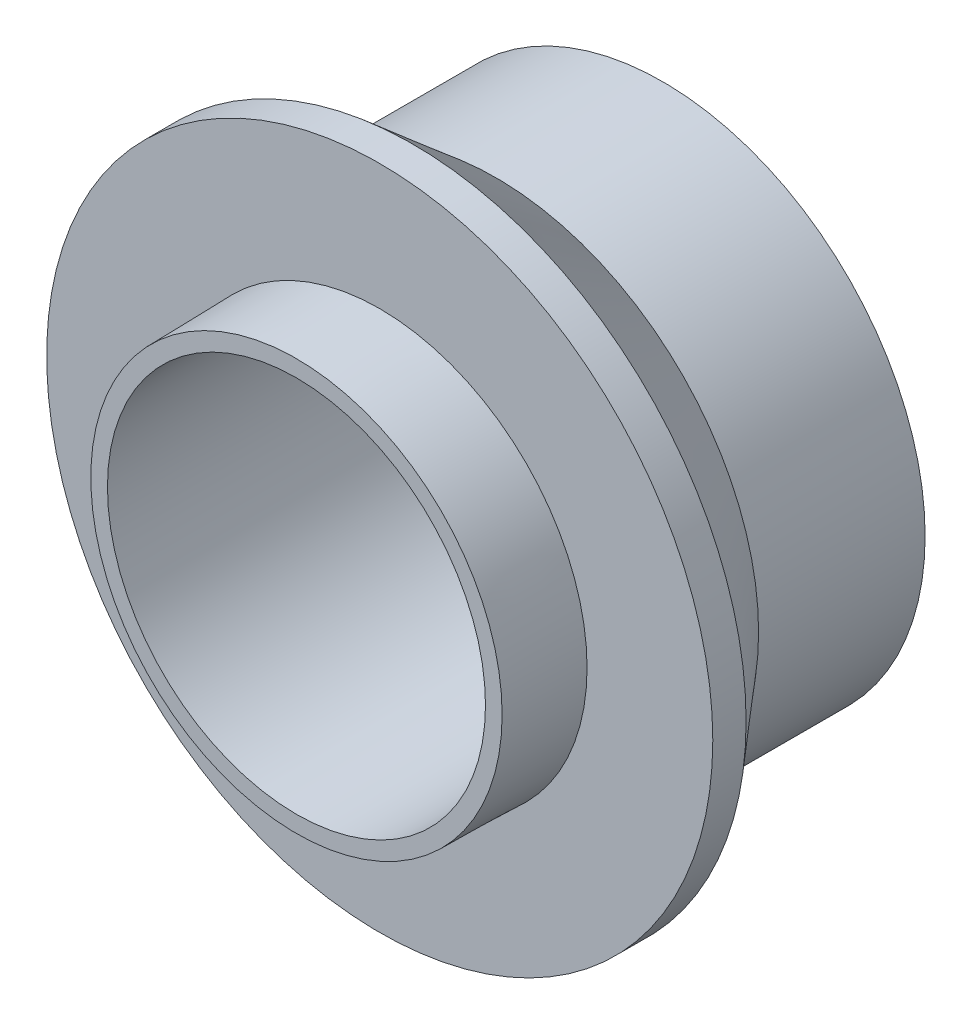
from build123d import *

# Parameters (mm, degrees)
SKETCH_10_R         = 15.75
EXTRUDE_5_DEPTH     = 10
SKETCH_12_R         = 20
SKETCH_14_R         = 20
EXTRUDE_6_DEPTH     = 2
SKETCH_16_R         = 12.35
SKETCH_15_R         = 12.45
SKETCH_17_R         = 11.35
CUT_EXTRUDE_3_DEPTH = 30


with BuildPart() as part:
    # 草图10 → 凸台-拉伸5 (new body)
    with BuildSketch(Plane.XY):
        Circle(SKETCH_10_R)
    extrude(amount=EXTRUDE_5_DEPTH)

    # 草图12 → section 0 of loft_5
    with BuildSketch(Plane.XY.offset(15), mode=Mode.PRIVATE) as loft_5_s0:
        Circle(SKETCH_12_R)
    # loft up to a face of the part (loft_5)
    loft([loft_5_s0.sketch, Face(Wire([part.edges().sort_by_distance((-10.781616918, 11.481255882, 10))[0]]))])

    # 草图14 → 凸台-拉伸6 (add)
    with BuildSketch(Plane.XY.offset(15)):
        Circle(SKETCH_14_R)
    extrude(amount=EXTRUDE_6_DEPTH)

    # 草图16 → 放样6 section 0
    with BuildSketch(Plane.XY.offset(22)):
        Circle(SKETCH_16_R)
    # 草图15 → 放样6 section 1
    with BuildSketch(Plane.XY.offset(17)):
        Circle(SKETCH_15_R)
    loft()

    # 草图17 → 切除-拉伸3 (cut)
    with BuildSketch(Plane.XY.offset(22)):
        Circle(SKETCH_17_R)
    extrude(amount=-CUT_EXTRUDE_3_DEPTH, mode=Mode.SUBTRACT)


solid = part.part
